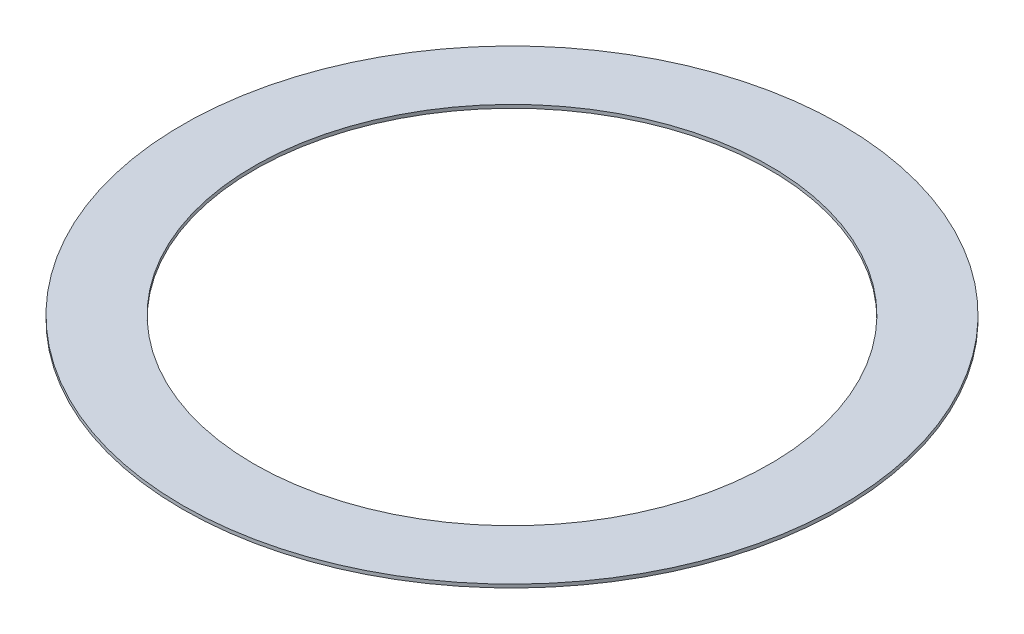
from build123d import *

# Parameters (mm, degrees)
SKETCH1_R           = 292.337683561
SKETCH1_R_2         = 228.887635764
BOSS_EXTRUDE1_DEPTH = 3


with BuildPart() as part:
    # Sketch1 → Boss-Extrude1 (new body)
    with BuildSketch(Plane(origin=(0, 0, 0), x_dir=(1, 0, 0), z_dir=(0, 1, 0))):
        with Locations(Location((0, 0, 0), (0, 0, 270))):
            Circle(SKETCH1_R)
        with Locations(Location((0, 0, 0), (0, 0, 270))):
            Circle(SKETCH1_R_2, mode=Mode.SUBTRACT)
    extrude(amount=BOSS_EXTRUDE1_DEPTH)


solid = part.part
